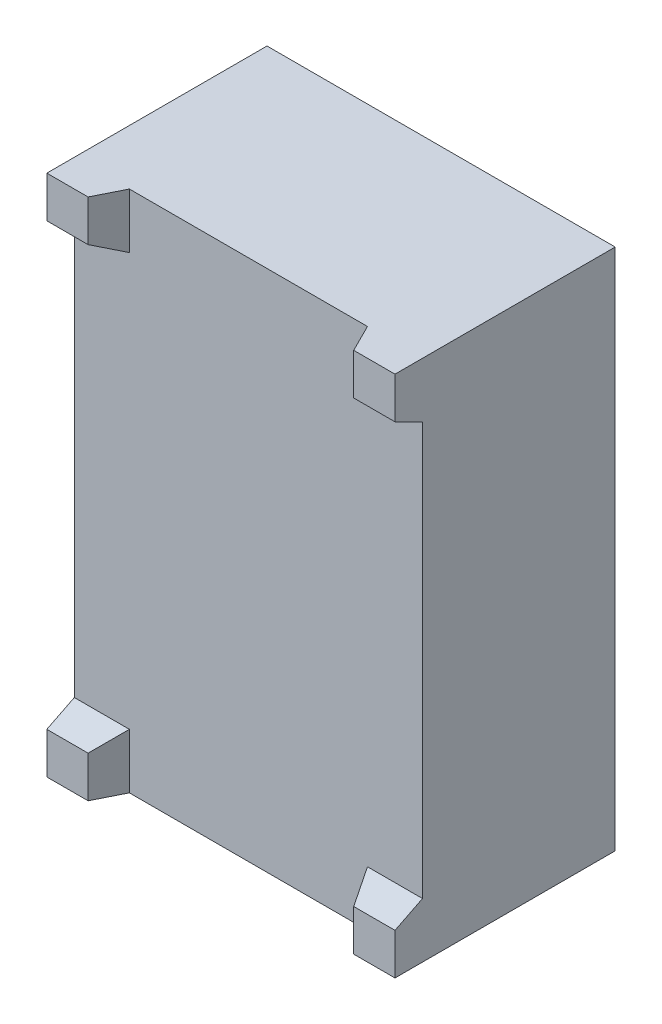
from build123d import *

# Parameters (mm, degrees)
IZIM1_W                       = 12.65
IZIM1_H                       = 19
Y_KSEKLIK_EKSTR_ZYON1_DEPTH   = 7.75
KES_EKSTR_ZYON1_DEPTH         = 22.472496944
KES_EKSTR_ZYON2_DEPTH         = 18.616327654
IZIM4_W                       = 12.35
IZIM4_H                       = 18.7
IZIM4_R                       = 0.75
Y_KSEKLIK_EKSTR_ZYON2_DEPTH   = 0.25
IZIM5_R                       = 0.75
Y_KSEKLIK_EKSTR_ZYON3_DEPTH   = 0.25
Y_KSEKLIK_EKSTR_ZYON3_2_DEPTH = 0.25
Y_KSEKLIK_EKSTR_ZYON3_3_DEPTH = 0.25
Y_KSEKLIK_EKSTR_ZYON3_4_DEPTH = 0.25
Y_KSEKLIK_EKSTR_ZYON3_5_DEPTH = 0.25
Y_KSEKLIK_EKSTR_ZYON3_6_DEPTH = 0.25
Y_KSEKLIK_EKSTR_ZYON3_7_DEPTH = 0.25
Y_KSEKLIK_EKSTR_ZYON3_8_DEPTH = 0.25
IZIM6_W                       = 12.65
IZIM6_H                       = 19
IZIM6_W_2                     = 12.35
IZIM6_H_2                     = 18.7
Y_KSEKLIK_EKSTR_ZYON4_DEPTH   = 0.25


with BuildPart() as part:
    # Çizim1 → Yükseklik-Ekstrüzyon1 (new body)
    with BuildSketch(Plane.XY):
        Rectangle(IZIM1_W, IZIM1_H)
    extrude(amount=Y_KSEKLIK_EKSTR_ZYON1_DEPTH)

    # Çizim2 → Kes-Ekstrüzyon1 (cut, through all)
    with BuildSketch(Plane(origin=(0, 9.5, 0), x_dir=(1, 0, 0), z_dir=(0, 1, 0))):
        Polygon((-4.325, -6.75), (-4.825, -7.75), (4.825, -7.75), (4.325, -6.75), align=None)
    extrude(amount=-KES_EKSTR_ZYON1_DEPTH, mode=Mode.SUBTRACT)

    # Çizim3 → Kes-Ekstrüzyon2 (cut, through all)
    with BuildSketch(Plane.ZY.offset(6.325)):
        Polygon((7.75, 8), (6.75, 7.5), (6.75, -7.5), (7.75, -8), align=None)
    extrude(amount=-KES_EKSTR_ZYON2_DEPTH, mode=Mode.SUBTRACT)



with BuildPart() as body_2:
    # Çizim4 → Yükseklik-Ekstrüzyon2 (new body)
    with BuildSketch(Plane(origin=(0, 0, 0), x_dir=(-1, 0, 0), z_dir=(0, 0, -1))):
        with Locations((0, 0.008624693)):
            Rectangle(IZIM4_W, IZIM4_H)
        with Locations((4.975, -6.091375307)):
            Circle(IZIM4_R, mode=Mode.SUBTRACT)
        with BuildLine():
            Line((5.00792639, 5.714170462), (4.246733621, 0.5))
            Line((4.246733621, 0.5), (3.746733621, 0.5))
            Line((3.746733621, 0.5), (2.878348659, 1.401563009))
            Line((2.878348659, 1.401563009), (3.675, 6.858624693))
            Line((3.675, 6.858624693), (4.018414907, 6.858624693))
            ThreePointArc((4.018414907, 6.858624693), (4.774871855, 6.512668181), (5.00792639, 5.714170462))
        make_face(mode=Mode.SUBTRACT)
        with BuildLine():
            Line((1.675, -6.841375307), (2.310385709, -6.841375307))
            ThreePointArc((2.310385709, -6.841375307), (2.964429198, -6.597832256), (3.299897193, -5.985829538))
            Line((3.299897193, -5.985829538), (4.10074822, -0.5))
            Line((4.10074822, -0.5), (3.60074822, -0.5))
            Line((3.60074822, -0.5), (2.491259169, -1.25))
            Line((2.491259169, -1.25), (1.675, -6.841375307))
        make_face(mode=Mode.SUBTRACT)
        with BuildLine():
            Line((-3.299897193, 6.003078924), (-4.103266379, 0.5))
            Line((-4.103266379, 0.5), (-3.603266379, 0.5))
            Line((-3.603266379, 0.5), (-2.506640402, 1.161887938))
            Line((-2.506640402, 1.161887938), (-1.675, 6.858624693))
            Line((-1.675, 6.858624693), (-2.310385709, 6.858624693))
            ThreePointArc((-2.310385709, 6.858624693), (-2.964429198, 6.615081642), (-3.299897193, 6.003078924))
        make_face(mode=Mode.SUBTRACT)
        with BuildLine():
            Line((-5.00792639, -5.696921076), (-4.24925178, -0.5))
            Line((-4.24925178, -0.5), (-3.74925178, -0.5))
            Line((-3.74925178, -0.5), (-2.858740831, -1.25))
            Line((-2.858740831, -1.25), (-3.675, -6.841375307))
            Line((-3.675, -6.841375307), (-4.018414907, -6.841375307))
            ThreePointArc((-4.018414907, -6.841375307), (-4.774871855, -6.495418795), (-5.00792639, -5.696921076))
        make_face(mode=Mode.SUBTRACT)
        Polygon((-3.071994015, -5.341375307), (-3.290972117, -6.841375307), (1.290972117, -6.841375307), (1.509950219, -5.341375307), align=None, mode=Mode.SUBTRACT)
        Polygon((-2.506640402, 0.75), (2.878348659, 0.75), (3.60074822, 0), (2.491259169, -0.75), (-2.858740831, -0.75), (-3.74925178, 0), align=None, mode=Mode.SUBTRACT)
        Polygon((-1.290972117, 6.858624693), (-1.509950219, 5.358624693), (3.071994015, 5.358624693), (3.290972117, 6.858624693), align=None, mode=Mode.SUBTRACT)
    extrude(amount=Y_KSEKLIK_EKSTR_ZYON2_DEPTH)


with BuildPart() as body_3:
    # Çizim5 → Yükseklik-Ekstrüzyon3 (new body)
    with BuildSketch(Plane(origin=(0, 0, -0.25), x_dir=(-1, 0, 0), z_dir=(0, 0, -1))):
        with Locations((4.975, -6.091375307)):
            Circle(IZIM5_R)
    extrude(amount=-Y_KSEKLIK_EKSTR_ZYON3_DEPTH)


with BuildPart() as body_4:
    # Çizim5 → Y_kseklik-Ekstr_zyon3 2 (new body)
    with BuildSketch(Plane(origin=(0, 0, -0.25), x_dir=(-1, 0, 0), z_dir=(0, 0, -1))):
        Polygon((3.290972117, 6.858624693), (-1.290972117, 6.858624693), (-1.509950219, 5.358624693), (3.071994015, 5.358624693), align=None)
    extrude(amount=-Y_KSEKLIK_EKSTR_ZYON3_2_DEPTH)


with BuildPart() as body_5:
    # Çizim5 → Y_kseklik-Ekstr_zyon3 3 (new body)
    with BuildSketch(Plane(origin=(0, 0, -0.25), x_dir=(-1, 0, 0), z_dir=(0, 0, -1))):
        with BuildLine():
            Line((-2.506640402, 1.161887938), (-1.675, 6.858624693))
            Line((-1.675, 6.858624693), (-2.310385709, 6.858624693))
            ThreePointArc((-2.310385709, 6.858624693), (-2.964429198, 6.615081642), (-3.299897193, 6.003078924))
            Line((-3.299897193, 6.003078924), (-4.103266379, 0.5))
            Line((-4.103266379, 0.5), (-3.603266379, 0.5))
            Line((-3.603266379, 0.5), (-2.506640402, 1.161887938))
        make_face()
    extrude(amount=-Y_KSEKLIK_EKSTR_ZYON3_3_DEPTH)


with BuildPart() as body_6:
    # Çizim5 → Y_kseklik-Ekstr_zyon3 4 (new body)
    with BuildSketch(Plane(origin=(0, 0, -0.25), x_dir=(-1, 0, 0), z_dir=(0, 0, -1))):
        Polygon((-2.506640402, 0.75), (-3.74925178, 0), (-2.858740831, -0.75), (2.491259169, -0.75), (3.60074822, 0), (2.878348659, 0.75), align=None)
    extrude(amount=-Y_KSEKLIK_EKSTR_ZYON3_4_DEPTH)


with BuildPart() as body_7:
    # Çizim5 → Y_kseklik-Ekstr_zyon3 5 (new body)
    with BuildSketch(Plane(origin=(0, 0, -0.25), x_dir=(-1, 0, 0), z_dir=(0, 0, -1))):
        with BuildLine():
            Line((-2.858740831, -1.25), (-3.74925178, -0.5))
            Line((-3.74925178, -0.5), (-4.24925178, -0.5))
            Line((-4.24925178, -0.5), (-5.00792639, -5.696921076))
            ThreePointArc((-5.00792639, -5.696921076), (-4.774871855, -6.495418795), (-4.018414907, -6.841375307))
            Line((-4.018414907, -6.841375307), (-3.675, -6.841375307))
            Line((-3.675, -6.841375307), (-2.858740831, -1.25))
        make_face()
    extrude(amount=-Y_KSEKLIK_EKSTR_ZYON3_5_DEPTH)


with BuildPart() as body_8:
    # Çizim5 → Y_kseklik-Ekstr_zyon3 6 (new body)
    with BuildSketch(Plane(origin=(0, 0, -0.25), x_dir=(-1, 0, 0), z_dir=(0, 0, -1))):
        with BuildLine():
            Line((3.675, 6.858624693), (2.878348659, 1.401563009))
            Line((2.878348659, 1.401563009), (3.746733621, 0.5))
            Line((3.746733621, 0.5), (4.246733621, 0.5))
            Line((4.246733621, 0.5), (5.00792639, 5.714170462))
            ThreePointArc((5.00792639, 5.714170462), (4.774871855, 6.512668181), (4.018414907, 6.858624693))
            Line((4.018414907, 6.858624693), (3.675, 6.858624693))
        make_face()
    extrude(amount=-Y_KSEKLIK_EKSTR_ZYON3_6_DEPTH)


with BuildPart() as body_9:
    # Çizim5 → Y_kseklik-Ekstr_zyon3 7 (new body)
    with BuildSketch(Plane(origin=(0, 0, -0.25), x_dir=(-1, 0, 0), z_dir=(0, 0, -1))):
        with BuildLine():
            Line((3.60074822, -0.5), (2.491259169, -1.25))
            Line((2.491259169, -1.25), (1.675, -6.841375307))
            Line((1.675, -6.841375307), (2.310385709, -6.841375307))
            ThreePointArc((2.310385709, -6.841375307), (2.964429198, -6.597832256), (3.299897193, -5.985829538))
            Line((3.299897193, -5.985829538), (4.10074822, -0.5))
            Line((4.10074822, -0.5), (3.60074822, -0.5))
        make_face()
    extrude(amount=-Y_KSEKLIK_EKSTR_ZYON3_7_DEPTH)


with BuildPart() as body_10:
    # Çizim5 → Y_kseklik-Ekstr_zyon3 8 (new body)
    with BuildSketch(Plane(origin=(0, 0, -0.25), x_dir=(-1, 0, 0), z_dir=(0, 0, -1))):
        Polygon((-3.071994015, -5.341375307), (-3.290972117, -6.841375307), (1.290972117, -6.841375307), (1.509950219, -5.341375307), align=None)
    extrude(amount=-Y_KSEKLIK_EKSTR_ZYON3_8_DEPTH)


with BuildPart() as part_1:
    add(part.part)

    add(body_2.part)  # Yükseklik-Ekstrüzyon4 merges body 2
    # Çizim6 → Yükseklik-Ekstrüzyon4 (add, through all)
    with BuildSketch(Plane(origin=(0, 0, 0), x_dir=(-1, 0, 0), z_dir=(0, 0, -1))):
        Rectangle(IZIM6_W, IZIM6_H)
        with Locations((0, 0.008624693)):
            Rectangle(IZIM6_W_2, IZIM6_H_2, mode=Mode.SUBTRACT)
    extrude(amount=Y_KSEKLIK_EKSTR_ZYON4_DEPTH)


solid = Compound([body_3.part, body_4.part, body_5.part, body_6.part, body_7.part, body_8.part, body_9.part, body_10.part, part_1.part])
